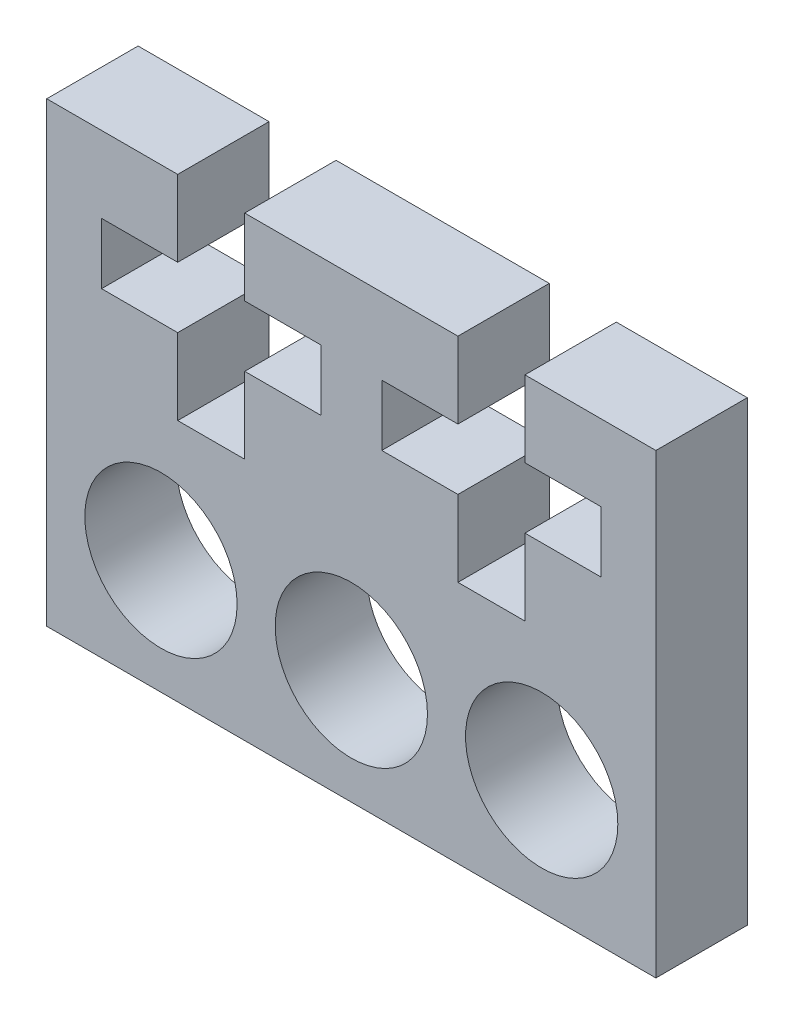
from build123d import *

# Parameters (mm, degrees)
SKETCH1_R           = 2.5
BOSS_EXTRUDE1_DEPTH = 3


with BuildPart() as part:
    # Sketch1 → Boss-Extrude1 (new body)
    with BuildSketch(Plane.XY):
        Polygon((-10, -7.5), (10, -7.5), (10, 7.5), (5.7, 7.5), (5.7, 5), (8.2, 5), (8.2, 3), (5.7, 3), (5.7, 0.5), (3.5, 0.5), (3.5, 3), (1, 3), (1, 5), (3.5, 5), (3.5, 7.5), (-3.5, 7.5), (-3.5, 5), (-1, 5), (-1, 3), (-3.5, 3), (-3.5, 0.5), (-5.7, 0.5), (-5.7, 3), (-8.2, 3), (-8.2, 5), (-5.7, 5), (-5.7, 7.5), (-10, 7.5), align=None)
        with Locations((0, -3.75)):
            Circle(SKETCH1_R, mode=Mode.SUBTRACT)
        with Locations((-6.25, -3.75)):
            Circle(SKETCH1_R, mode=Mode.SUBTRACT)
        with Locations((6.25, -3.75)):
            Circle(SKETCH1_R, mode=Mode.SUBTRACT)
    extrude(amount=BOSS_EXTRUDE1_DEPTH)


solid = part.part
